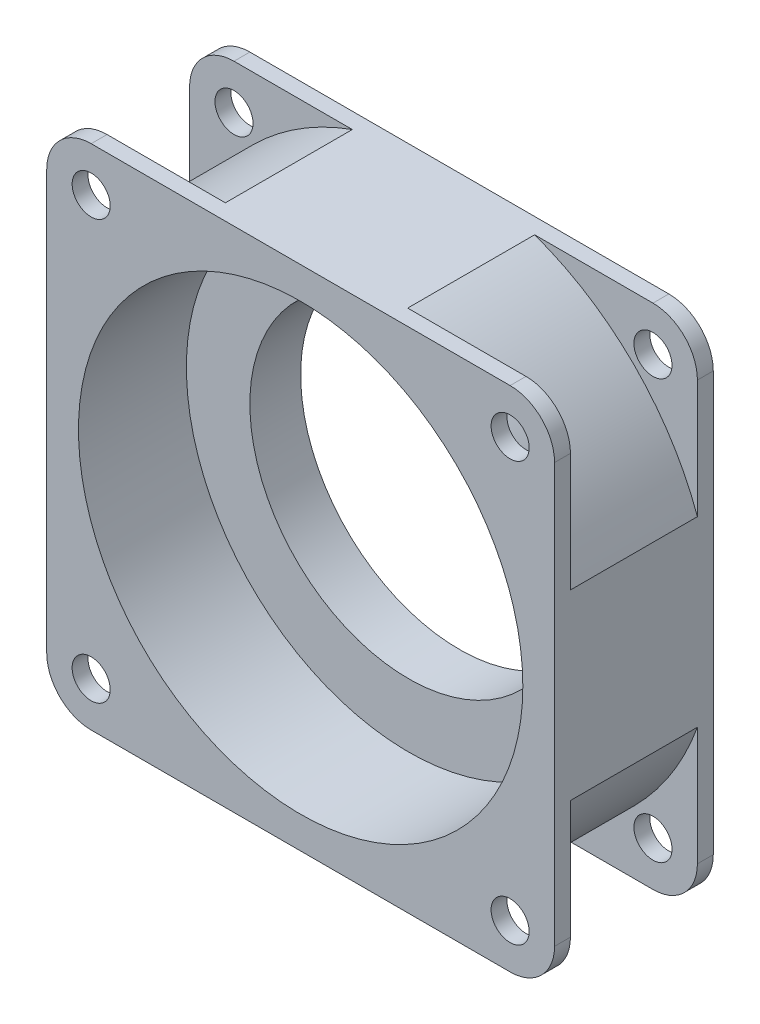
from build123d import *

# Parameters (mm, degrees)
SKETCH1_R           = 25
SKETCH1_R_2         = 3
BOSS_EXTRUDE1_DEPTH = 12.5
CUT_EXTRUDE2_DEPTH  = 10
CUT_EXTRUDE3_START  = -4.5
SKETCH2_4_R         = 35
SKETCH2_4_R_2       = 25
CUT_EXTRUDE3_DEPTH  = 17


with BuildPart() as part:
    # Sketch1 → Boss-Extrude1 (new, symmetric)
    with BuildSketch(Plane.XY):
        with BuildLine():
            Line((-33, -40), (33, -40))
            ThreePointArc((33, -40), (37.949747468, -37.949747468), (40, -33))
            Line((40, -33), (40, 33))
            ThreePointArc((40, 33), (37.949747468, 37.949747468), (33, 40))
            Line((33, 40), (-33, 40))
            ThreePointArc((-33, 40), (-37.949747468, 37.949747468), (-40, 33))
            Line((-40, 33), (-40, -33))
            ThreePointArc((-40, -33), (-37.949747468, -37.949747468), (-33, -40))
        make_face()
        Circle(SKETCH1_R, mode=Mode.SUBTRACT)
        with Locations((-33, 33)):
            Circle(SKETCH1_R_2, mode=Mode.SUBTRACT)
        with Locations((33, 33)):
            Circle(SKETCH1_R_2, mode=Mode.SUBTRACT)
        with Locations((-33, -33)):
            Circle(SKETCH1_R_2, mode=Mode.SUBTRACT)
        with Locations((33, -33)):
            Circle(SKETCH1_R_2, mode=Mode.SUBTRACT)
    extrude(amount=BOSS_EXTRUDE1_DEPTH, both=True)

    # Sketch2 → Cut-Extrude2 (cut, symmetric)
    with BuildSketch(Plane.XY):
        with BuildLine():
            Line((-40, 33), (-40, 14.361406616))
            ThreePointArc((-40, 14.361406616), (-30.0520382, 30.0520382), (-14.361406616, 40))
            Line((-14.361406616, 40), (-33, 40))
            ThreePointArc((-33, 40), (-37.949747468, 37.949747468), (-40, 33))
        make_face()
        with BuildLine():
            Line((33, 40), (14.361406616, 40))
            ThreePointArc((14.361406616, 40), (30.0520382, 30.0520382), (40, 14.361406616))
            Line((40, 14.361406616), (40, 33))
            ThreePointArc((40, 33), (37.949747468, 37.949747468), (33, 40))
        make_face()
        with BuildLine():
            ThreePointArc((40, -14.361406616), (30.0520382, -30.0520382), (14.361406616, -40))
            Line((14.361406616, -40), (33, -40))
            ThreePointArc((33, -40), (37.949747468, -37.949747468), (40, -33))
            Line((40, -33), (40, -14.361406616))
        make_face()
        with BuildLine():
            ThreePointArc((-14.361406616, -40), (-30.0520382, -30.0520382), (-40, -14.361406616))
            Line((-40, -14.361406616), (-40, -33))
            ThreePointArc((-40, -33), (-37.949747468, -37.949747468), (-33, -40))
            Line((-33, -40), (-14.361406616, -40))
        make_face()
    extrude(amount=CUT_EXTRUDE2_DEPTH, both=True, mode=Mode.SUBTRACT)

    # Sketch2<4> → Cut-Extrude3 (cut)
    with BuildSketch(Plane.XY.offset(CUT_EXTRUDE3_START)):
        Circle(SKETCH2_4_R)
        Circle(SKETCH2_4_R_2, mode=Mode.SUBTRACT)
    extrude(amount=CUT_EXTRUDE3_DEPTH, mode=Mode.SUBTRACT)


solid = part.part
